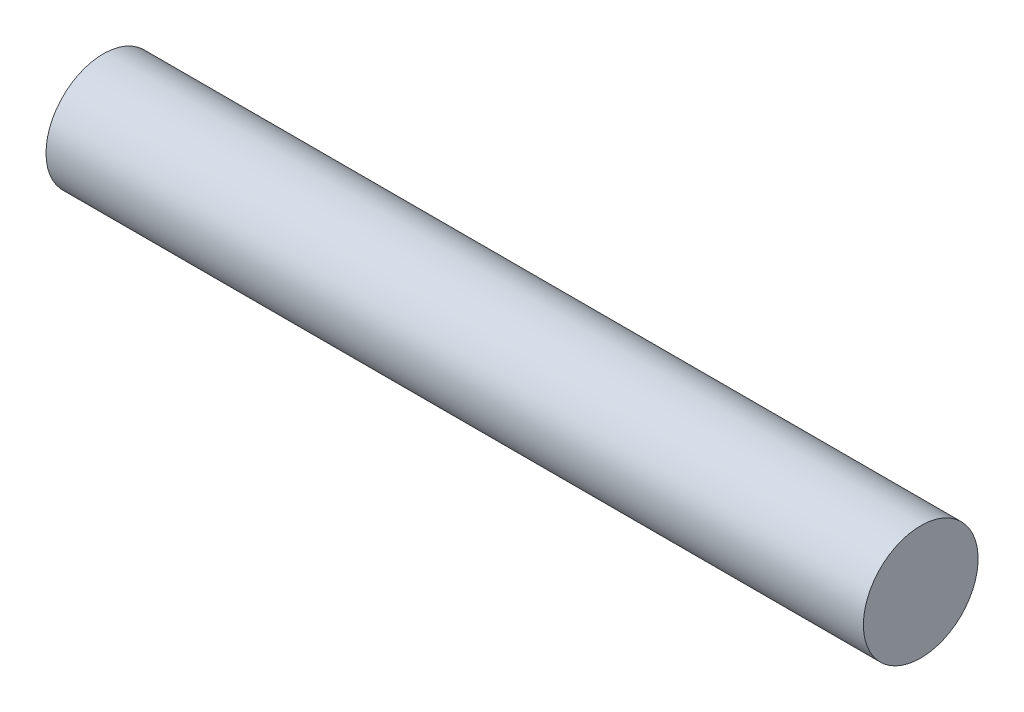
from build123d import *

# Parameters (mm, degrees)
SKETCH1_W = 57
SKETCH1_H = 4


with BuildPart() as part:
    # Sketch1 → Revolve1 (revolve)
    with BuildSketch(Plane.XY, mode=Mode.PRIVATE) as revolve1_sk:
        with Locations((0, 2)):
            Rectangle(SKETCH1_W, SKETCH1_H)
    revolve(revolve1_sk.sketch.rotate(Axis((-38.901213553, 0, 0), (1, 0, 0)), 90), axis=Axis((-38.901213553, 0, 0), (1, 0, 0)))


solid = part.part
